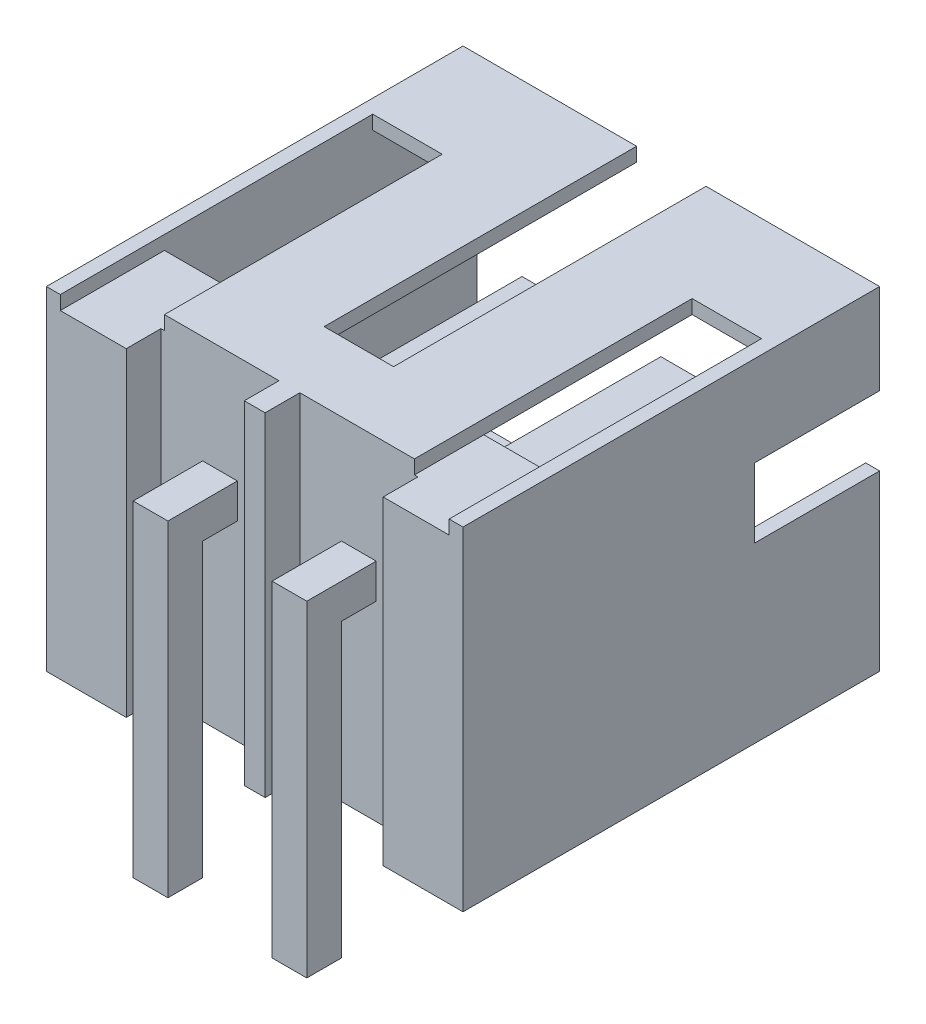
from build123d import *

# Parameters (mm, degrees)
SKETCH_1_W           = 6
SKETCH_1_H           = 4.8
SKETCH_1_W_2         = 5.6
SKETCH_1_H_2         = 4.4
EXTRUDE_1_DEPTH      = 6
SKETCH_2_W           = 5.6
SKETCH_2_H           = 4.4
EXTRUDE_1_2_DEPTH    = 1.5
SKETCH_3_W           = 1
SKETCH_3_H           = 4.5
CUT_EXTRUDE_1_DEPTH  = 0.2
SKETCH_4_W           = 1.8
SKETCH_4_H           = 1
CUT_EXTRUDE_2_DEPTH  = 9.818163074
SKETCH_5_W           = 0.5
SKETCH_5_H           = 0.5
EXTRUDE_2_DEPTH      = 3.7
SKETCH_7_W           = 1.7
SKETCH_7_H           = 4.8
CUT_EXTRUDE_3_DEPTH  = 0.5
EXTRUDE_3_DEPTH      = 0.5
EXTRUDE_3_DEPTH_BACK = 0.5
SKETCH_6_W           = 0.5
SKETCH_6_H           = 0.5
SKETCH_8_W           = 0.5
SKETCH_8_H           = 0.5
EXTRUDE_4_DEPTH      = 4.8
CHAMFER_1_SIZE       = 0.1


with BuildPart() as part:
    # 草图1 → Extrude 1 (new body)
    with BuildSketch(Plane.XY):
        Rectangle(SKETCH_1_W, SKETCH_1_H)
        Rectangle(SKETCH_1_W_2, SKETCH_1_H_2, mode=Mode.SUBTRACT)
    extrude(amount=EXTRUDE_1_DEPTH)

    # 草图2 → Extrude 1 2 (add)
    with BuildSketch(Plane.XY.offset(6)):
        Rectangle(SKETCH_2_W, SKETCH_2_H)
    extrude(amount=-EXTRUDE_1_2_DEPTH)

    # 草图3 → 切除-拉伸1 (cut)
    with BuildSketch(Plane(origin=(0, 2.4, 0), x_dir=(1, 0, 0), z_dir=(0, 1, 0))):
        Polygon((0, 0), (0.5, 0), (0.5, -4.5), (-0.5, -4.5), (-0.5, 0), align=None)
        with Locations((-2.3, -3.75)):
            Rectangle(SKETCH_3_W, SKETCH_3_H)
        with Locations((2.3, -3.75)):
            Rectangle(SKETCH_3_W, SKETCH_3_H)
    extrude(amount=-CUT_EXTRUDE_1_DEPTH, mode=Mode.SUBTRACT)

    # 草图4 → 切除-拉伸2 (cut, through all)
    with BuildSketch(Plane.ZY.offset(3)):
        with Locations((0.9, 0.6)):
            Rectangle(SKETCH_4_W, SKETCH_4_H)
    extrude(amount=-CUT_EXTRUDE_2_DEPTH, mode=Mode.SUBTRACT)

    # 草图5 → 凸台-拉伸2 (add)
    with BuildSketch(Plane(origin=(0, 0, 4.5), x_dir=(-1, 0, 0), z_dir=(0, 0, -1))):
        with Locations((-1, 0.6)):
            Rectangle(SKETCH_5_W, SKETCH_5_H)
        with Locations((1, 0.6)):
            Rectangle(SKETCH_5_W, SKETCH_5_H)
    extrude(amount=EXTRUDE_2_DEPTH)

    # 草图7 → 切除-拉伸3 (cut)
    with BuildSketch(Plane.XY.offset(6)):
        with Locations((-1, 0)):
            Rectangle(SKETCH_7_W, SKETCH_7_H)
        with Locations((1, 0)):
            Rectangle(SKETCH_7_W, SKETCH_7_H)
    extrude(amount=-CUT_EXTRUDE_3_DEPTH, mode=Mode.SUBTRACT)

    # 草图6 → 凸台-拉伸3 (add, two sides: drawn at the far end of the back side and taken through both)
    with BuildSketch(Plane.XY.offset(6).offset(-EXTRUDE_3_DEPTH_BACK)):
        with Locations((-1, 0.6)):
            Rectangle(SKETCH_6_W, SKETCH_6_H)
        with Locations((1, 0.6)):
            Rectangle(SKETCH_6_W, SKETCH_6_H)
    extrude(amount=EXTRUDE_3_DEPTH + EXTRUDE_3_DEPTH_BACK)

    # 草图8 → 凸台-拉伸4 (add)
    with BuildSketch(Plane(origin=(0, 0.85, 0), x_dir=(1, 0, 0), z_dir=(0, 1, 0))):
        with Locations((-1, -6.25)):
            Rectangle(SKETCH_8_W, SKETCH_8_H)
        with Locations((1, -6.25)):
            Rectangle(SKETCH_8_W, SKETCH_8_H)
    extrude(amount=-EXTRUDE_4_DEPTH)

    # 倒角1
    chamfer_1_edges = [part.edges().sort_by_distance(p)[0] for p in [
        (0.75, 0.6, 0.8),
        (1, 0.85, 0.8),
        (1.25, 0.6, 0.8),
        (1, 0.35, 0.8),
        (-1.25, 0.6, 0.8),
        (-1, 0.85, 0.8),
        (-0.75, 0.6, 0.8),
        (-1, 0.35, 0.8),
        (-1.25, -3.95, 6.25),
        (-1, -3.95, 6),
        (-0.75, -3.95, 6.25),
        (-1, -3.95, 6.5),
        (0.75, -3.95, 6.25),
        (1, -3.95, 6),
        (1.25, -3.95, 6.25),
        (1, -3.95, 6.5),
    ]]
    chamfer(chamfer_1_edges, length=CHAMFER_1_SIZE)


solid = part.part
